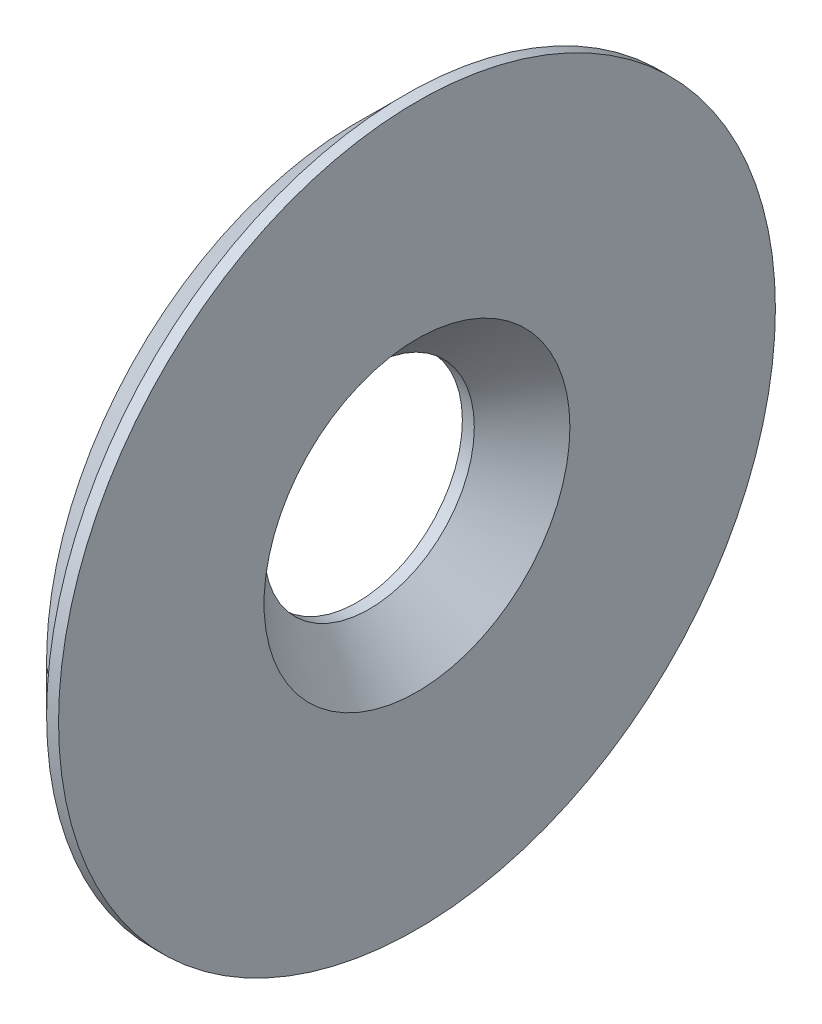
from build123d import *

# Parameters (mm, degrees)
SKETCH1_R          = 15
SKETCH1_R_2        = 4.4
BASE_EXTRUDE_DEPTH = 2.5
CHAMFER1_SIZE      = 2


with BuildPart() as part:
    # Sketch1 → Base-Extrude (new body)
    with BuildSketch(Plane(origin=(0, 0, 0), x_dir=(0, 0, -1), z_dir=(1, 0, 0))):
        Circle(SKETCH1_R)
        Circle(SKETCH1_R_2, mode=Mode.SUBTRACT)
    extrude(amount=BASE_EXTRUDE_DEPTH)

    # Chamfer1
    chamfer1_edges = [part.edges().sort_by_distance(p)[0] for p in [
        (0, 0, 15),
        (2.5, 0, 4.4),
    ]]
    chamfer(chamfer1_edges, length=CHAMFER1_SIZE)


solid = part.part
